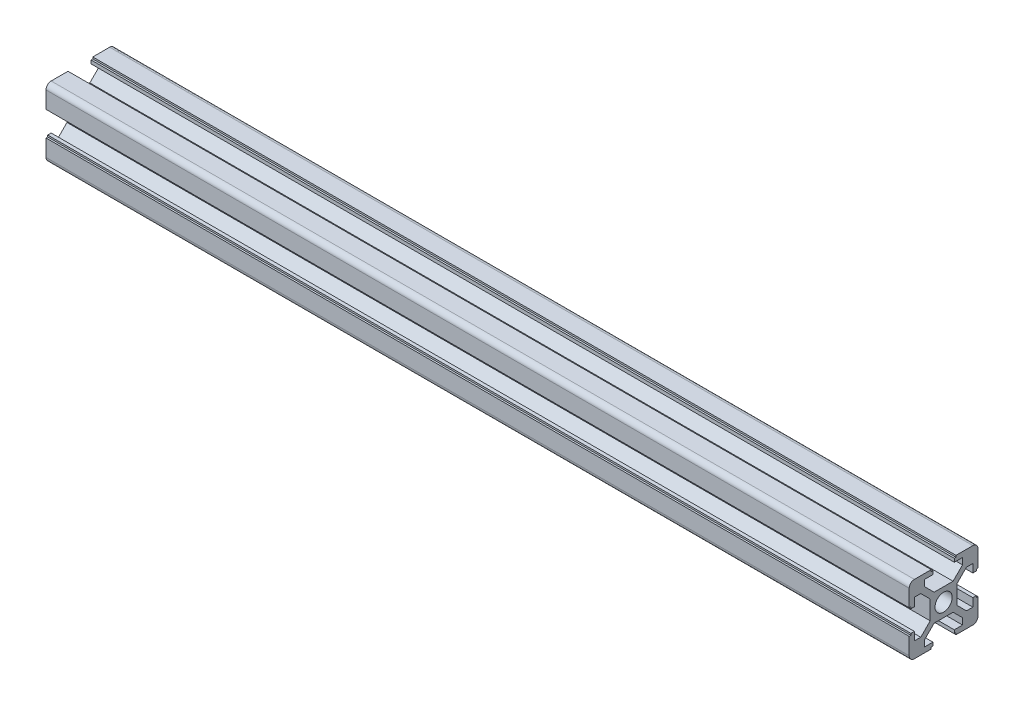
from build123d import *

# Parameters (mm, degrees)
SKETCH1_R                = 2.5
F_20_X_20_X_R1_5_1_DEPTH = 251


with BuildPart() as part:
    # Sketch1 → 铝型材 20 X 20 X R1.5(1) (new body)
    with BuildSketch(Plane(origin=(0, 0, 0), x_dir=(0, 0, -1), z_dir=(1, 0, 0))):
        with BuildLine():
            Line((-3.6, 10), (-3.6, 9.5))
            Line((-3.6, 9.5), (-3.1, 9.5))
            Line((-3.1, 9.5), (-3.1, 8.5))
            Line((-3.1, 8.5), (-5.5, 8.5))
            Line((-5.5, 8.5), (-5.5, 6.65))
            Line((-5.5, 6.65), (-2.75, 3.9))
            Line((-2.75, 3.9), (2.75, 3.9))
            Line((2.75, 3.9), (5.5, 6.65))
            Line((5.5, 6.65), (5.5, 8.5))
            Line((5.5, 8.5), (3.1, 8.5))
            Line((3.1, 8.5), (3.1, 9.5))
            Line((3.1, 9.5), (3.6, 9.5))
            Line((3.6, 9.5), (3.6, 10))
            Line((3.6, 10), (8.5, 10))
            ThreePointArc((8.5, 10), (9.560660172, 9.560660172), (10, 8.5))
            Line((10, 8.5), (10, 3.6))
            Line((10, 3.6), (9.5, 3.6))
            Line((9.5, 3.6), (9.5, 3.1))
            Line((9.5, 3.1), (8.5, 3.1))
            Line((8.5, 3.1), (8.5, 5.5))
            Line((8.5, 5.5), (6.65, 5.5))
            Line((6.65, 5.5), (3.9, 2.75))
            Line((3.9, 2.75), (3.9, -2.75))
            Line((3.9, -2.75), (6.65, -5.5))
            Line((6.65, -5.5), (8.5, -5.5))
            Line((8.5, -5.5), (8.5, -3.1))
            Line((8.5, -3.1), (9.5, -3.1))
            Line((9.5, -3.1), (9.5, -3.6))
            Line((9.5, -3.6), (10, -3.6))
            Line((10, -3.6), (10, -8.5))
            ThreePointArc((10, -8.5), (9.560660172, -9.560660172), (8.5, -10))
            Line((8.5, -10), (3.6, -10))
            Line((3.6, -10), (3.6, -9.5))
            Line((3.6, -9.5), (3.1, -9.5))
            Line((3.1, -9.5), (3.1, -8.5))
            Line((3.1, -8.5), (5.5, -8.5))
            Line((5.5, -8.5), (5.5, -6.65))
            Line((5.5, -6.65), (2.75, -3.9))
            Line((2.75, -3.9), (-2.75, -3.9))
            Line((-2.75, -3.9), (-5.5, -6.65))
            Line((-5.5, -6.65), (-5.5, -8.5))
            Line((-5.5, -8.5), (-3.1, -8.5))
            Line((-3.1, -8.5), (-3.1, -9.5))
            Line((-3.1, -9.5), (-3.6, -9.5))
            Line((-3.6, -9.5), (-3.6, -10))
            Line((-3.6, -10), (-8.5, -10))
            ThreePointArc((-8.5, -10), (-9.560660172, -9.560660172), (-10, -8.5))
            Line((-10, -8.5), (-10, -3.6))
            Line((-10, -3.6), (-9.5, -3.6))
            Line((-9.5, -3.6), (-9.5, -3.1))
            Line((-9.5, -3.1), (-8.5, -3.1))
            Line((-8.5, -3.1), (-8.5, -5.5))
            Line((-8.5, -5.5), (-6.65, -5.5))
            Line((-6.65, -5.5), (-3.9, -2.75))
            Line((-3.9, -2.75), (-3.9, 2.75))
            Line((-3.9, 2.75), (-6.65, 5.5))
            Line((-6.65, 5.5), (-8.5, 5.5))
            Line((-8.5, 5.5), (-8.5, 3.1))
            Line((-8.5, 3.1), (-9.5, 3.1))
            Line((-9.5, 3.1), (-9.5, 3.6))
            Line((-9.5, 3.6), (-10, 3.6))
            Line((-10, 3.6), (-10, 8.5))
            ThreePointArc((-10, 8.5), (-9.560660172, 9.560660172), (-8.5, 10))
            Line((-8.5, 10), (-3.6, 10))
        make_face()
        Circle(SKETCH1_R, mode=Mode.SUBTRACT)
    extrude(amount=F_20_X_20_X_R1_5_1_DEPTH)


solid = part.part
